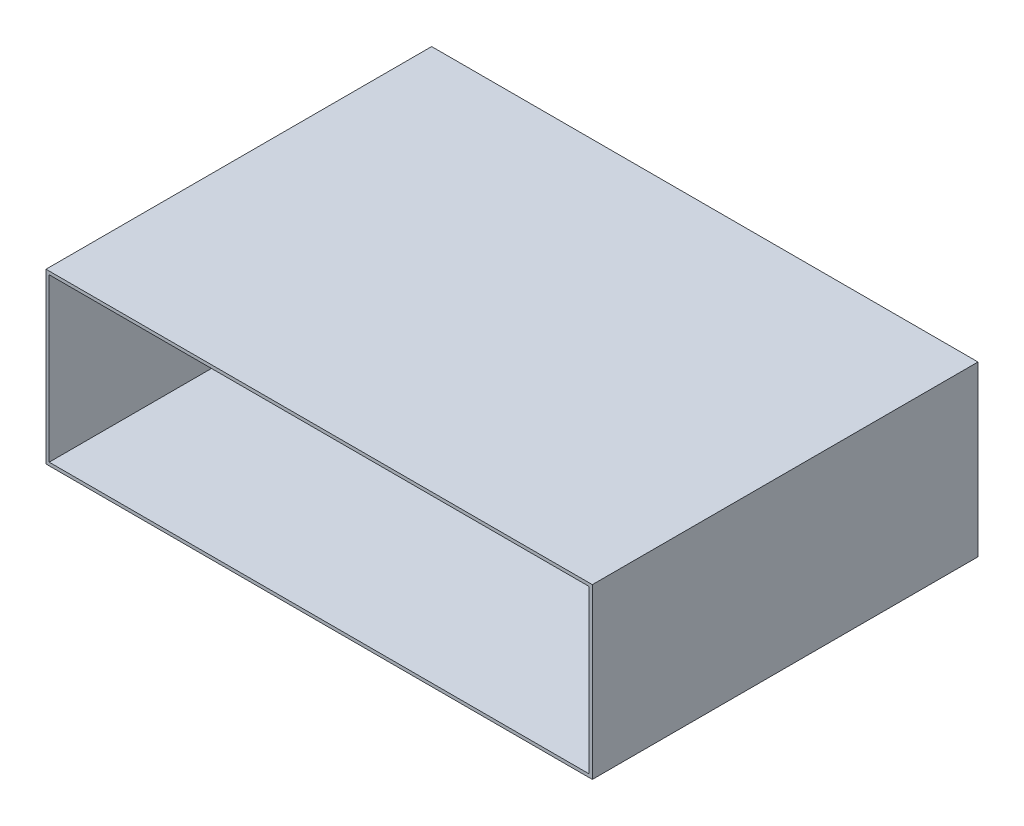
from build123d import *

# Parameters (mm, degrees)
SKETCH1_W           = 431.8
SKETCH1_H           = 304.8
BOSS_EXTRUDE1_DEPTH = 133.35
CUT_EXTRUDE1_START  = 2.54
SKETCH2_W           = 426.72
SKETCH2_H           = 302.26
CUT_EXTRUDE1_DEPTH  = 128.27


with BuildPart() as part:
    # Sketch1 → Boss-Extrude1 (new body)
    with BuildSketch(Plane(origin=(0, 0, 0), x_dir=(1, 0, 0), z_dir=(0, 1, 0))):
        Rectangle(SKETCH1_W, SKETCH1_H)
    extrude(amount=BOSS_EXTRUDE1_DEPTH)

    # Sketch2 → Cut-Extrude1 (cut)
    with BuildSketch(Plane(origin=(0, 0, 0), x_dir=(1, 0, 0), z_dir=(0, 1, 0)).offset(CUT_EXTRUDE1_START)):
        with Locations((0, -1.27)):
            Rectangle(SKETCH2_W, SKETCH2_H)
    extrude(amount=CUT_EXTRUDE1_DEPTH, mode=Mode.SUBTRACT)


solid = part.part
